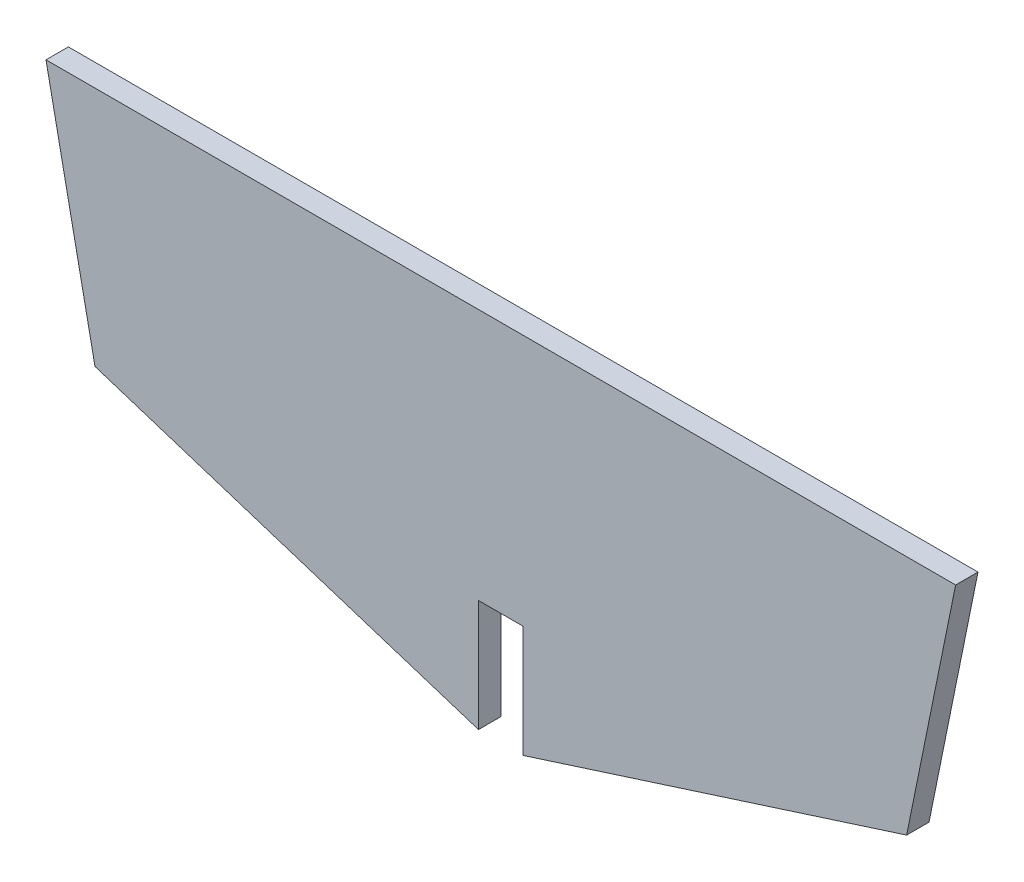
from build123d import *

# Parameters (mm, degrees)
BOSS_EXTRU_1_DEPTH = 3


with BuildPart() as part:
    # Esquisse1 → Boss.-Extru.1 (new body)
    with BuildSketch(Plane.XY):
        Polygon((-26.423413348, 16.431604979), (95.576586652, 16.431604979), (89.006616663, -15.907774953), (37.576586652, -32.368395021), (37.576586652, -17.368395021), (31.576586652, -17.368395021), (31.576586652, -32.368395021), (-19.853443359, -15.907774953), align=None)
    extrude(amount=BOSS_EXTRU_1_DEPTH)


solid = part.part
